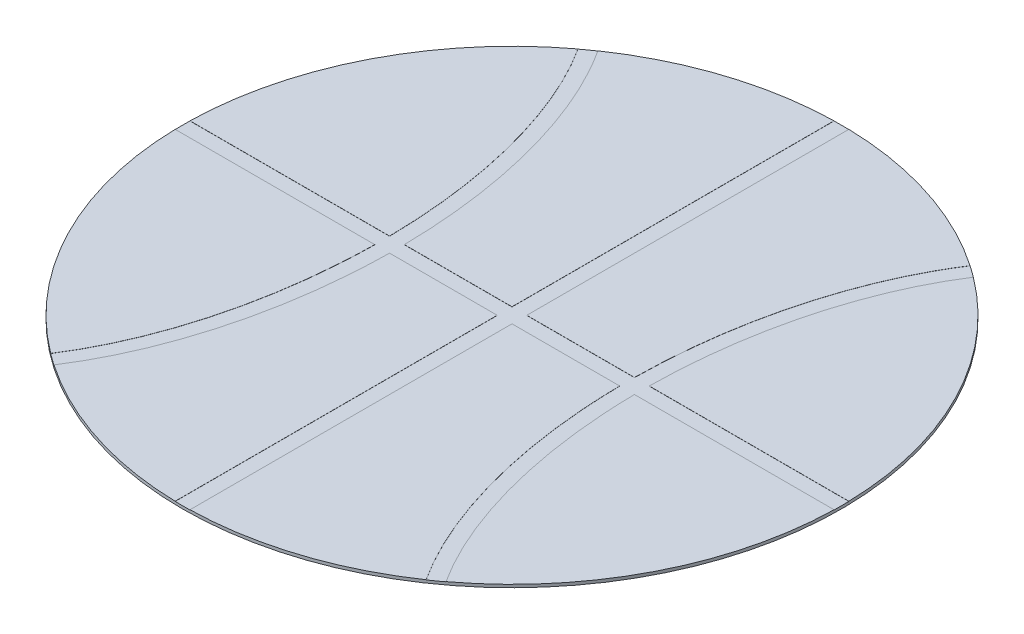
from build123d import *

# Parameters (mm, degrees)
SKETCH1_R           = 22.3
BOSS_EXTRUDE1_DEPTH = 0.2
CUT_EXTRUDE1_START  = -0.01
SKETCH2_W           = 1
SKETCH2_H           = 1
CUT_EXTRUDE1_DEPTH  = 0.01


with BuildPart() as part:
    # Sketch1 → Boss-Extrude1 (new body)
    with BuildSketch(Plane(origin=(0, 0, 0), x_dir=(1, 0, 0), z_dir=(0, 1, 0))):
        with Locations(Location((0, 0, 0), (0, 0, 270))):
            Circle(SKETCH1_R)
    extrude(amount=BOSS_EXTRUDE1_DEPTH)

    # Sketch2 → Cut-Extrude1 (cut)
    with BuildSketch(Plane(origin=(0, 0.2, 0), x_dir=(1, 0, 0), z_dir=(0, 1, 0)).offset(CUT_EXTRUDE1_START)):
        with BuildLine():
            add(Edge.make_bspline(
                [(-7.785590959, 0.5), (-7.912713042, 11.228724898), (-12.591992017, 18.404666176)],
                knots=[4.732589507, 4.732589507, 4.732589507, 5.550703884, 5.550703884, 5.550703884], degree=2, weights=[1, 0.917496228, 1]))
            ThreePointArc((-12.591992017, 18.404666176), (-12.987412835, 18.127799311), (-13.376748201, 17.842438386))
            add(Edge.make_bspline(
                [(-8.785624057, 0.5), (-8.910774379, 10.945499623), (-13.376748201, 17.842438386)],
                knots=[4.733440053, 4.733440053, 4.733440053, 5.562190564, 5.562190564, 5.562190564], degree=2, weights=[1, 0.915368033, 1]))
            Line((-8.785624057, 0.5), (-7.785590959, 0.5))
        make_face()
        with BuildLine():
            add(Edge.make_bspline(
                [(-12.591992017, -18.404666176), (-7.912713042, -11.228724898), (-7.785590959, -0.5)],
                knots=[3.874074076, 3.874074076, 3.874074076, 4.692188454, 4.692188454, 4.692188454], degree=2, weights=[1, 0.917496228, 1]))
            Line((-7.785590959, -0.5), (-8.785624057, -0.5))
            add(Edge.make_bspline(
                [(-13.376748201, -17.842438386), (-8.910774379, -10.945499623), (-8.785624057, -0.5)],
                knots=[3.862587397, 3.862587397, 3.862587397, 4.691337908, 4.691337908, 4.691337908], degree=2, weights=[1, 0.915368033, 1]))
            ThreePointArc((-13.376748201, -17.842438386), (-12.987412835, -18.127799311), (-12.591992017, -18.404666176))
        make_face()
        with BuildLine():
            Line((8.785624057, -0.5), (7.785590959, -0.5))
            add(Edge.make_bspline(
                [(7.785590959, -0.5), (7.912713042, -11.228724898), (12.591992017, -18.404666176)],
                knots=[1.590996853, 1.590996853, 1.590996853, 2.409111231, 2.409111231, 2.409111231], degree=2, weights=[1, 0.917496228, 1]))
            ThreePointArc((12.591992017, -18.404666176), (12.987412835, -18.127799311), (13.376748201, -17.842438386))
            add(Edge.make_bspline(
                [(8.785624057, -0.5), (8.910774379, -10.945499623), (13.376748201, -17.842438386)],
                knots=[1.591847399, 1.591847399, 1.591847399, 2.42059791, 2.42059791, 2.42059791], degree=2, weights=[1, 0.915368033, 1]))
        make_face()
        with BuildLine():
            ThreePointArc((13.376748201, 17.842438386), (12.987412835, 18.127799311), (12.591992017, 18.404666176))
            add(Edge.make_bspline(
                [(12.591992017, 18.404666176), (7.912713042, 11.228724898), (7.785590959, 0.5)],
                knots=[0.732481423, 0.732481423, 0.732481423, 1.5505958, 1.5505958, 1.5505958], degree=2, weights=[1, 0.917496228, 1]))
            Line((7.785590959, 0.5), (8.785624057, 0.5))
            add(Edge.make_bspline(
                [(13.376748201, 17.842438386), (8.910774379, 10.945499623), (8.785624057, 0.5)],
                knots=[0.720994743, 0.720994743, 0.720994743, 1.549745255, 1.549745255, 1.549745255], degree=2, weights=[1, 0.915368033, 1]))
        make_face()
        with BuildLine():
            Line((22.294393914, 0.5), (8.785624057, 0.5))
            add(Edge.make_bspline(
                [(8.785624057, 0.5), (8.779633423, 0), (8.785624057, -0.5)],
                knots=[1.549745255, 1.549745255, 1.549745255, 1.591847399, 1.591847399, 1.591847399], degree=2, weights=[1, 0.999778434, 1]))
            Line((8.785624057, -0.5), (22.294393914, -0.5))
            ThreePointArc((22.294393914, -0.5), (22.298598434, -0.250015714), (22.3, 0))
            ThreePointArc((22.3, 0), (22.298598434, 0.250015714), (22.294393914, 0.5))
        make_face()
        with BuildLine():
            Line((8.785624057, 0.5), (7.785590959, 0.5))
            add(Edge.make_bspline(
                [(7.785590959, 0.5), (7.779666579, 0), (7.785590959, -0.5)],
                knots=[1.5505958, 1.5505958, 1.5505958, 1.590996853, 1.590996853, 1.590996853], degree=2, weights=[1, 0.999795976, 1]))
            Line((7.785590959, -0.5), (8.785624057, -0.5))
            add(Edge.make_bspline(
                [(8.785624057, 0.5), (8.779633423, 0), (8.785624057, -0.5)],
                knots=[1.549745255, 1.549745255, 1.549745255, 1.591847399, 1.591847399, 1.591847399], degree=2, weights=[1, 0.999778434, 1]))
        make_face()
        with BuildLine():
            Line((7.785590959, 0.5), (0.5, 0.5))
            Line((0.5, 0.5), (0.5, -0.5))
            Line((0.5, -0.5), (7.785590959, -0.5))
            add(Edge.make_bspline(
                [(7.785590959, 0.5), (7.779666579, 0), (7.785590959, -0.5)],
                knots=[1.5505958, 1.5505958, 1.5505958, 1.590996853, 1.590996853, 1.590996853], degree=2, weights=[1, 0.999795976, 1]))
        make_face()
        Rectangle(SKETCH2_W, SKETCH2_H)
        with BuildLine():
            Line((0.5, -22.294393914), (0.5, -0.5))
            Line((0.5, -0.5), (-0.5, -0.5))
            Line((-0.5, -0.5), (-0.5, -22.294393914))
            ThreePointArc((-0.5, -22.294393914), (0, -22.3), (0.5, -22.294393914))
        make_face()
        with BuildLine():
            Line((0.5, 0.5), (0.5, 22.294393914))
            ThreePointArc((0.5, 22.294393914), (0, 22.3), (-0.5, 22.294393914))
            Line((-0.5, 22.294393914), (-0.5, 0.5))
            Line((-0.5, 0.5), (0.5, 0.5))
        make_face()
        with BuildLine():
            Line((-0.5, -0.5), (-0.5, 0.5))
            Line((-0.5, 0.5), (-7.785590959, 0.5))
            add(Edge.make_bspline(
                [(-7.785590959, -0.5), (-7.779666579, 0), (-7.785590959, 0.5)],
                knots=[4.692188454, 4.692188454, 4.692188454, 4.732589507, 4.732589507, 4.732589507], degree=2, weights=[1, 0.999795976, 1]))
            Line((-7.785590959, -0.5), (-0.5, -0.5))
        make_face()
        with BuildLine():
            add(Edge.make_bspline(
                [(-7.785590959, -0.5), (-7.779666579, 0), (-7.785590959, 0.5)],
                knots=[4.692188454, 4.692188454, 4.692188454, 4.732589507, 4.732589507, 4.732589507], degree=2, weights=[1, 0.999795976, 1]))
            Line((-7.785590959, 0.5), (-8.785624057, 0.5))
            add(Edge.make_bspline(
                [(-8.785624057, -0.5), (-8.779633423, 0), (-8.785624057, 0.5)],
                knots=[4.691337908, 4.691337908, 4.691337908, 4.733440053, 4.733440053, 4.733440053], degree=2, weights=[1, 0.999778434, 1]))
            Line((-8.785624057, -0.5), (-7.785590959, -0.5))
        make_face()
        with BuildLine():
            add(Edge.make_bspline(
                [(-8.785624057, -0.5), (-8.779633423, 0), (-8.785624057, 0.5)],
                knots=[4.691337908, 4.691337908, 4.691337908, 4.733440053, 4.733440053, 4.733440053], degree=2, weights=[1, 0.999778434, 1]))
            Line((-8.785624057, 0.5), (-22.294393914, 0.5))
            ThreePointArc((-22.294393914, 0.5), (-22.3, 0), (-22.294393914, -0.5))
            Line((-22.294393914, -0.5), (-8.785624057, -0.5))
        make_face()
    extrude(amount=CUT_EXTRUDE1_DEPTH, mode=Mode.SUBTRACT)


solid = part.part
